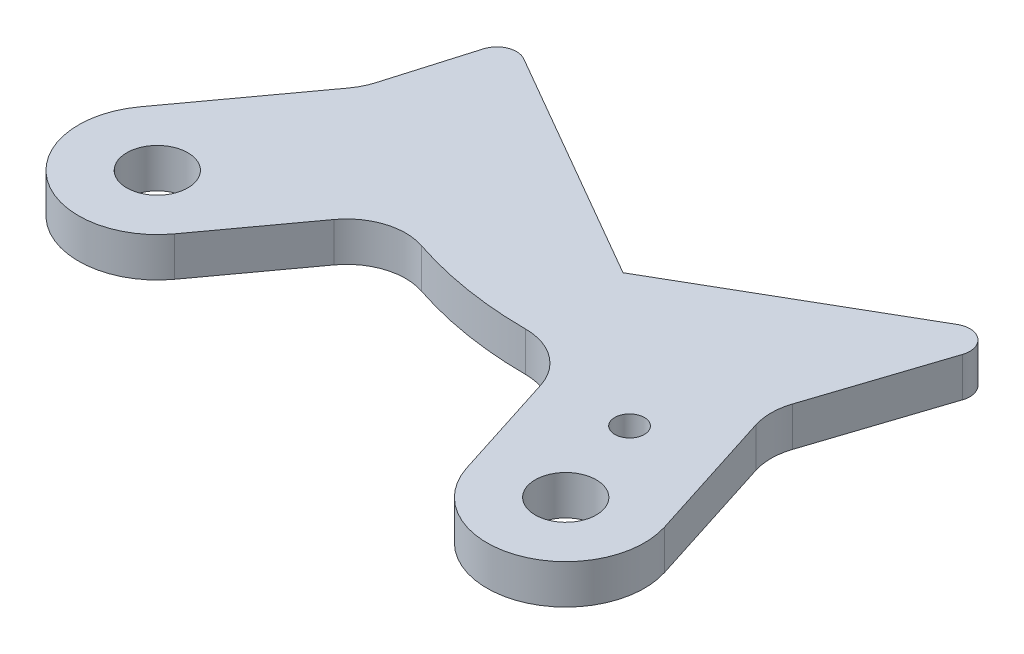
from build123d import *

# Parameters (mm, degrees)
SKETCH_1_R          = 1.55
EXTRUDE_1_DEPTH     = 2
CUT_EXTRUDE_2_DEPTH = 33.018928501
EXTRUDE_START       = -2
EXTRUDE_3_DEPTH     = 2
FILLET_1_R          = 3
FILLET_2_R          = 1
SKETCH_5_R          = 0.75
CUT_EXTRUDE_3_DEPTH = 10


with BuildPart() as part:
    # 草图1 → 凸台-拉伸1 (new body)
    with BuildSketch(Plane(origin=(0, 0, 0), x_dir=(1, 0, 0), z_dir=(0, 1, 0))):
        with BuildLine():
            Line((-9.427629845, 12.118007633), (-14.205972572, 5.57250637))
            ThreePointArc((-14.205972572, 5.57250637), (-13.333741258, -0.01669863), (-7.744536258, 0.855532684))
            Line((-7.744536258, 0.855532684), (-2.966193531, 7.401033946))
            ThreePointArc((-2.966193531, 7.401033946), (2.156455687, 5.844533995), (7.508476858, 5.702771934))
            Line((7.508476858, 5.702771934), (9.973957748, -2.017173013))
            ThreePointArc((9.973957748, -2.017173013), (15.001264118, -4.610663069), (17.594754173, 0.416643301))
            Line((17.594754173, 0.416643301), (15.129273283, 8.136588247))
            Line((15.129273283, 8.136588247), (19.53886034, 20.548398832))
            ThreePointArc((19.53886034, 20.548398832), (2.94865648, 10.730730666), (-9.689752685, 25.287244194))
            Line((-9.689752685, 25.287244194), (-9.427629845, 12.118007633))
        make_face()
        with Locations(Location((13.784355961, -0.800264856, 0), (0, 0, 270))):
            Circle(SKETCH_1_R, mode=Mode.SUBTRACT)
        with Locations(Location((-10.975254415, 3.214019527, 0), (0, 0, 270))):
            Circle(SKETCH_1_R, mode=Mode.SUBTRACT)
    extrude(amount=EXTRUDE_1_DEPTH)

    # 草图4 → 切除-拉伸2 (cut, through all)
    with BuildSketch(Plane(origin=(0, 2, 0), x_dir=(1, 0, 0), z_dir=(0, 1, 0))):
        with BuildLine():
            Line((-9.427629845, 12.118007633), (-7.676415353, 18.061742765))
            ThreePointArc((-7.676415353, 18.061742765), (-9.140437111, 21.54705512), (-9.689752685, 25.287244194))
            Line((-9.689752685, 25.287244194), (-9.427629845, 12.118007633))
        make_face()
        with BuildLine():
            ThreePointArc((19.53886034, 20.548398832), (19.021588119, 19.278904179), (18.3909493, 18.061742765))
            Line((18.3909493, 18.061742765), (15.129273283, 8.136588247))
            Line((15.129273283, 8.136588247), (19.53886034, 20.548398832))
        make_face()
    extrude(amount=-CUT_EXTRUDE_2_DEPTH, mode=Mode.SUBTRACT)

    # 草图4<3> → 凸台-拉伸3 (add)
    with BuildSketch(Plane(origin=(0, 2, 0), x_dir=(1, 0, 0), z_dir=(0, 1, 0)).offset(EXTRUDE_START)):
        with BuildLine():
            ThreePointArc((-7.676415353, 18.061742765), (-2.167733027, 12.553060438), (5.357266973, 10.536742765))
            Line((5.357266973, 10.536742765), (-7.676415353, 18.061742765))
        make_face()
        with BuildLine():
            ThreePointArc((5.357266973, 10.536742765), (12.882266973, 12.553060438), (18.3909493, 18.061742765))
            Line((18.3909493, 18.061742765), (5.357266973, 10.536742765))
        make_face()
    extrude(amount=EXTRUDE_3_DEPTH)

    # 圆角1
    fillet_1_edges = [part.edges().sort_by_distance(p)[0] for p in [
        (-9.427629845, 1, -12.118007633),
        (15.129273283, 1, -8.136588247),
        (7.508476858, 1, -5.702771934),
        (-2.966193531, 1, -7.401033946),
    ]]
    fillet(fillet_1_edges, radius=FILLET_1_R)

    # 圆角2
    fillet_2_edges = [part.edges().sort_by_distance(p)[0] for p in [
        (-7.676415353, 1, -18.061742765),
        (18.3909493, 1, -18.061742765),
    ]]
    fillet(fillet_2_edges, radius=FILLET_2_R)

    # 草图5 → 切除-拉伸3 (cut)
    with BuildSketch(Plane(origin=(0, 2, 0), x_dir=(1, 0, 0), z_dir=(0, 1, 0))):
        with Locations(Location((12.263220764, 3.962732909, 0), (0, 0, 270))):
            Circle(SKETCH_5_R)
    extrude(amount=-CUT_EXTRUDE_3_DEPTH, mode=Mode.SUBTRACT)


solid = part.part
